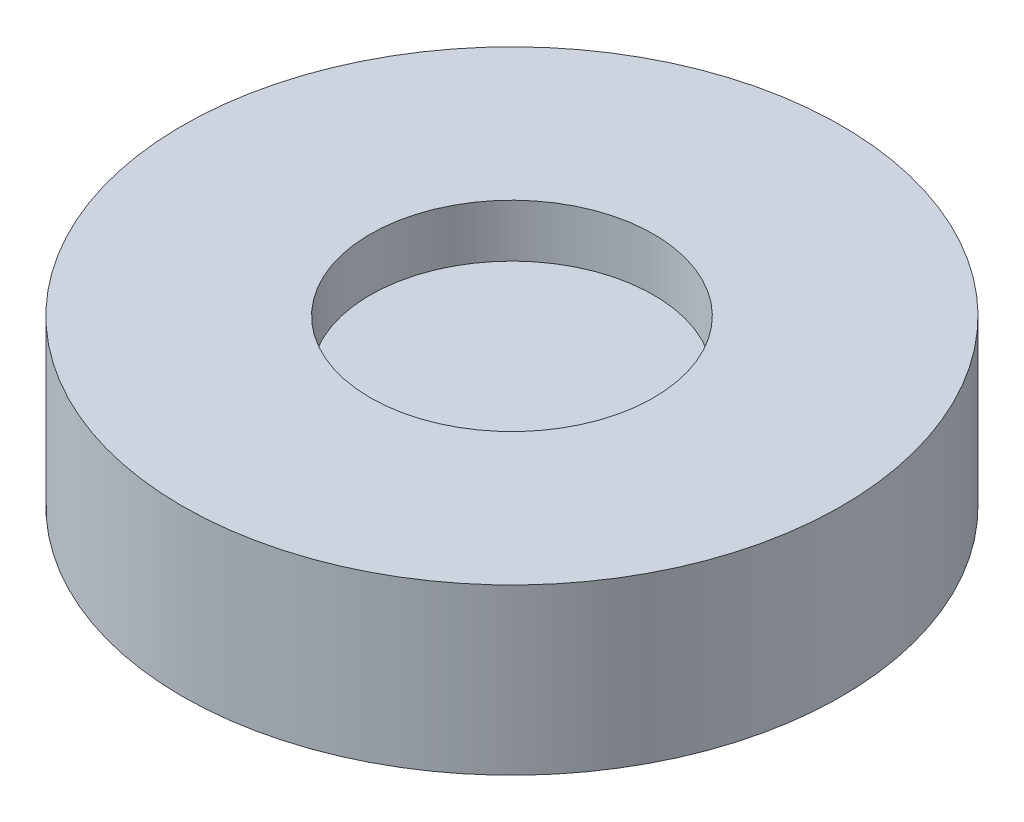
from build123d import *

# Parameters (mm, degrees)
SKETCH1_R           = 20
BOSS_EXTRUDE1_DEPTH = 10
SKETCH2_R           = 8.6
CUT_EXTRUDE2_DEPTH  = 3.2
SKETCH3_R           = 8.25
CUT_EXTRUDE3_DEPTH  = 1.8


with BuildPart() as part:
    # Sketch1 → Boss-Extrude1 (new body)
    with BuildSketch(Plane(origin=(0, 0, 0), x_dir=(1, 0, 0), z_dir=(0, 1, 0))):
        with Locations(Location((0, 0, 0), (0, 0, 270))):
            Circle(SKETCH1_R)
    extrude(amount=BOSS_EXTRUDE1_DEPTH)

    # Sketch2 → Cut-Extrude2 (cut)
    with BuildSketch(Plane(origin=(0, 10, 0), x_dir=(1, 0, 0), z_dir=(0, 1, 0))):
        with Locations(Location((0, 0, 0), (0, 0, 270))):
            Circle(SKETCH2_R)
    extrude(amount=-CUT_EXTRUDE2_DEPTH, mode=Mode.SUBTRACT)

    # Sketch3 → Cut-Extrude3 (cut)
    with BuildSketch(Plane.XZ):
        with Locations(Location((0, 0, 0), (0, 0, 270))):
            Circle(SKETCH3_R)
    extrude(amount=-CUT_EXTRUDE3_DEPTH, mode=Mode.SUBTRACT)


solid = part.part
